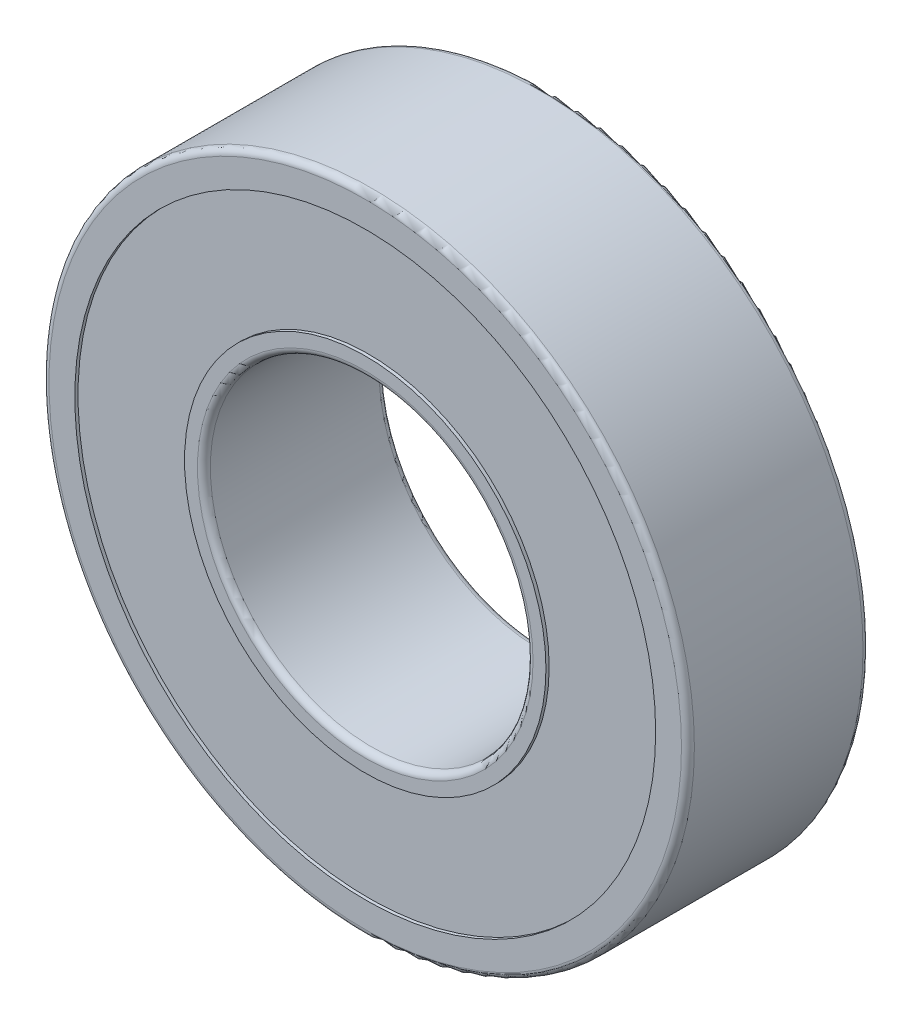
from build123d import *

# Parameters (mm, degrees)
SKETCH3_R             = 14.224
SKETCH3_R_2           = 12.7
BOSS_EXTRUDE1_DEPTH   = 14.2875
SKETCH3_R_3           = 25.4
SKETCH3_R_4           = 22.86
BOSS_EXTRUDE1_2_DEPTH = 14.2875
BOSS_EXTRUDE2_START   = 0.254
SKETCH3_3_R           = 22.86
SKETCH3_3_R_2         = 14.224
BOSS_EXTRUDE2_DEPTH   = 13.7795
FILLET1_R             = 0.508
FILLET2_R             = 0.508


with BuildPart() as part:
    # Sketch3 → Boss-Extrude1 (new body)
    with BuildSketch(Plane.XY):
        with Locations((147.733573081, -1.253039706)):
            Circle(SKETCH3_R)
        with Locations((147.733573081, -1.253039706)):
            Circle(SKETCH3_R_2, mode=Mode.SUBTRACT)
    extrude(amount=BOSS_EXTRUDE1_DEPTH)

    # Fillet1
    fillet1_edges = [part.edges().sort_by_distance(p)[0] for p in [
        (135.033573081, -1.253039706, 14.2875),
        (135.033573081, -1.253039706, 0),
    ]]
    fillet(fillet1_edges, radius=FILLET1_R)


with BuildPart() as body_2:
    # Sketch3 → Boss-Extrude1 2 (new body)
    with BuildSketch(Plane.XY):
        with Locations((147.733573081, -1.253039706)):
            Circle(SKETCH3_R_3)
        with Locations((147.733573081, -1.253039706)):
            Circle(SKETCH3_R_4, mode=Mode.SUBTRACT)
    extrude(amount=BOSS_EXTRUDE1_2_DEPTH)

    # Fillet2
    fillet2_edges = [body_2.edges().sort_by_distance(p)[0] for p in [
        (122.333573081, -1.253039706, 14.2875),
        (122.333573081, -1.253039706, 0),
    ]]
    fillet(fillet2_edges, radius=FILLET2_R)


with BuildPart() as body_3:
    # Sketch3<3> → Boss-Extrude2 (new body)
    with BuildSketch(Plane.XY.offset(BOSS_EXTRUDE2_START)):
        with Locations((147.733573081, -1.253039706)):
            Circle(SKETCH3_3_R)
        with Locations((147.733573081, -1.253039706)):
            Circle(SKETCH3_3_R_2, mode=Mode.SUBTRACT)
    extrude(amount=BOSS_EXTRUDE2_DEPTH)


solid = Compound([part.part, body_2.part, body_3.part])
